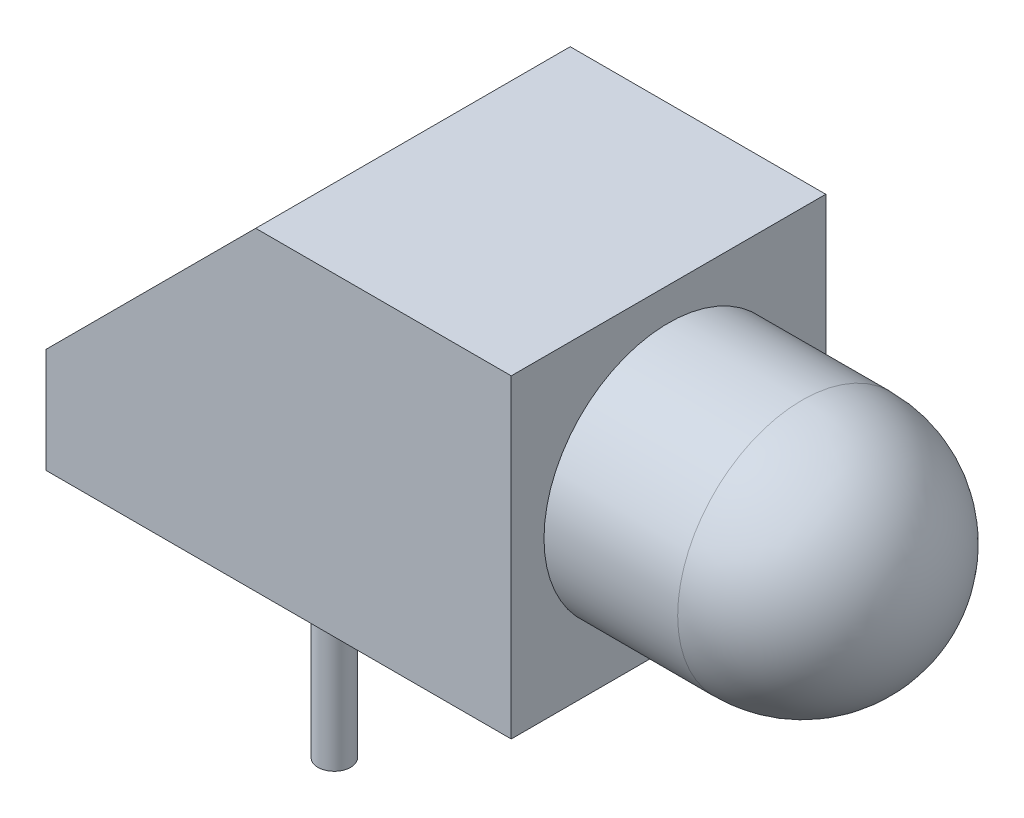
from build123d import *

# Parameters (mm, degrees)
EXTRUDE1_DEPTH = 3.048
SKETCH3_R      = 0.3175
EXTRUDE2_DEPTH = 3.81


with BuildPart() as part:
    # Sketch1 → Extrude1 (new, symmetric)
    with BuildSketch(Plane.XY):
        Polygon((0, 0), (0, 6.096), (-4.953, 6.096), (-9.017, 2.032), (-9.017, 0), align=None)
    extrude(amount=EXTRUDE1_DEPTH, both=True)

    # Sketch2 → Revolve1 (revolve)
    with BuildSketch(Plane.XY, mode=Mode.PRIVATE) as revolve1_sk:
        with BuildLine():
            Line((-1.016, 3.048), (5.0038, 3.048))
            ThreePointArc((5.0038, 3.048), (4.297048663, 4.754248663), (2.5908, 5.461))
            Line((2.5908, 5.461), (-1.016, 5.461))
            Line((-1.016, 5.461), (-1.016, 3.048))
        make_face()
    revolve(revolve1_sk.sketch.rotate(Axis((5.0038, 3.048, 0), (1, 0, 0)), 90), axis=Axis((5.0038, 3.048, 0), (1, 0, 0)))

    # Sketch3 → Extrude2 (add)
    with BuildSketch(Plane(origin=(0, 0, 0), x_dir=(1, 0, 0), z_dir=(0, 1, 0))):
        with Locations(Location((-5.207, -1.27, 0), (0, 0, 270))):
            Circle(SKETCH3_R)
        with Locations(Location((-5.207, 1.27, 0), (0, 0, 270))):
            Circle(SKETCH3_R)
    extrude(amount=-EXTRUDE2_DEPTH)


solid = part.part
